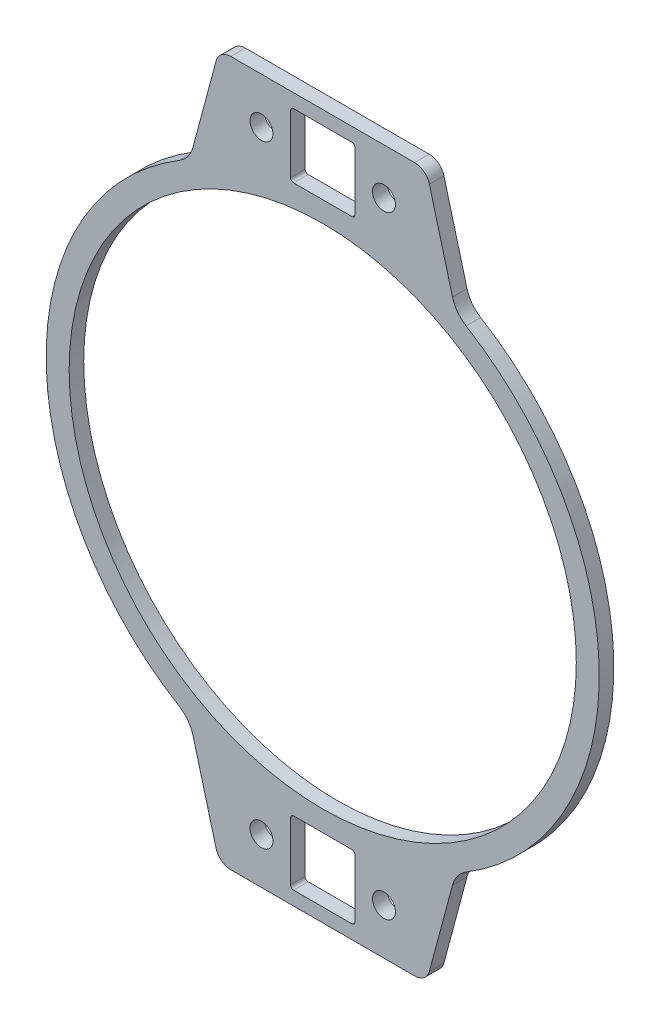
from build123d import *

# Parameters (mm, degrees)
SKETCH2_R           = 3.75
SKETCH2_R_2         = 82.8
BOSS_EXTRUDE1_DEPTH = 4.7498


with BuildPart() as part:
    # Sketch2 → Boss-Extrude1 (new body)
    with BuildSketch(Plane.XY.offset(-109.855)):
        with BuildLine():
            Line((34.829629131, -111.294095226), (42.367226853, -83.16339756))
            ThreePointArc((42.367226853, -83.16339756), (44.027245948, -79.750573703), (46.839397866, -77.202077741))
            ThreePointArc((46.839397866, -77.202077741), (90.3, 0), (46.839397866, 77.202077741))
            ThreePointArc((46.839397866, 77.202077741), (44.027245948, 79.750573703), (42.367226853, 83.16339756))
            Line((42.367226853, 83.16339756), (34.829629131, 111.294095226))
            ThreePointArc((34.829629131, 111.294095226), (33.043807145, 113.966766701), (30, 115))
            Line((30, 115), (-30, 115))
            ThreePointArc((-30, 115), (-33.043807145, 113.966766701), (-34.829629131, 111.294095226))
            Line((-34.829629131, 111.294095226), (-42.367226853, 83.16339756))
            ThreePointArc((-42.367226853, 83.16339756), (-44.027245948, 79.750573703), (-46.839397866, 77.202077741))
            ThreePointArc((-46.839397866, 77.202077741), (-90.3, 0), (-46.839397866, -77.202077741))
            ThreePointArc((-46.839397866, -77.202077741), (-44.027245948, -79.750573703), (-42.367226853, -83.16339756))
            Line((-42.367226853, -83.16339756), (-34.829629131, -111.294095226))
            ThreePointArc((-34.829629131, -111.294095226), (-33.043807145, -113.966766701), (-30, -115))
            Line((-30, -115), (30, -115))
            ThreePointArc((30, -115), (33.043807145, -113.966766701), (34.829629131, -111.294095226))
        make_face()
        with Locations((20, -100)):
            Circle(SKETCH2_R, mode=Mode.SUBTRACT)
        with Locations((-20, -100)):
            Circle(SKETCH2_R, mode=Mode.SUBTRACT)
        with Locations((-20, 100)):
            Circle(SKETCH2_R, mode=Mode.SUBTRACT)
        with Locations((20, 100)):
            Circle(SKETCH2_R, mode=Mode.SUBTRACT)
        Circle(SKETCH2_R_2, mode=Mode.SUBTRACT)
        with BuildLine():
            Line((9.5, 89.5), (-9.5, 89.5))
            ThreePointArc((-9.5, 89.5), (-10.207106781, 89.792893219), (-10.5, 90.5))
            Line((-10.5, 90.5), (-10.5, 109.5))
            ThreePointArc((-10.5, 109.5), (-10.207106781, 110.207106781), (-9.5, 110.5))
            Line((-9.5, 110.5), (9.5, 110.5))
            ThreePointArc((9.5, 110.5), (10.207106781, 110.207106781), (10.5, 109.5))
            Line((10.5, 109.5), (10.5, 90.5))
            ThreePointArc((10.5, 90.5), (10.207106781, 89.792893219), (9.5, 89.5))
        make_face(mode=Mode.SUBTRACT)
        with BuildLine():
            Line((9.5, -110.5), (-9.5, -110.5))
            ThreePointArc((-9.5, -110.5), (-10.207106781, -110.207106781), (-10.5, -109.5))
            Line((-10.5, -109.5), (-10.5, -90.5))
            ThreePointArc((-10.5, -90.5), (-10.207106781, -89.792893219), (-9.5, -89.5))
            Line((-9.5, -89.5), (9.5, -89.5))
            ThreePointArc((9.5, -89.5), (10.207106781, -89.792893219), (10.5, -90.5))
            Line((10.5, -90.5), (10.5, -109.5))
            ThreePointArc((10.5, -109.5), (10.207106781, -110.207106781), (9.5, -110.5))
        make_face(mode=Mode.SUBTRACT)
    extrude(amount=BOSS_EXTRUDE1_DEPTH)


solid = part.part
